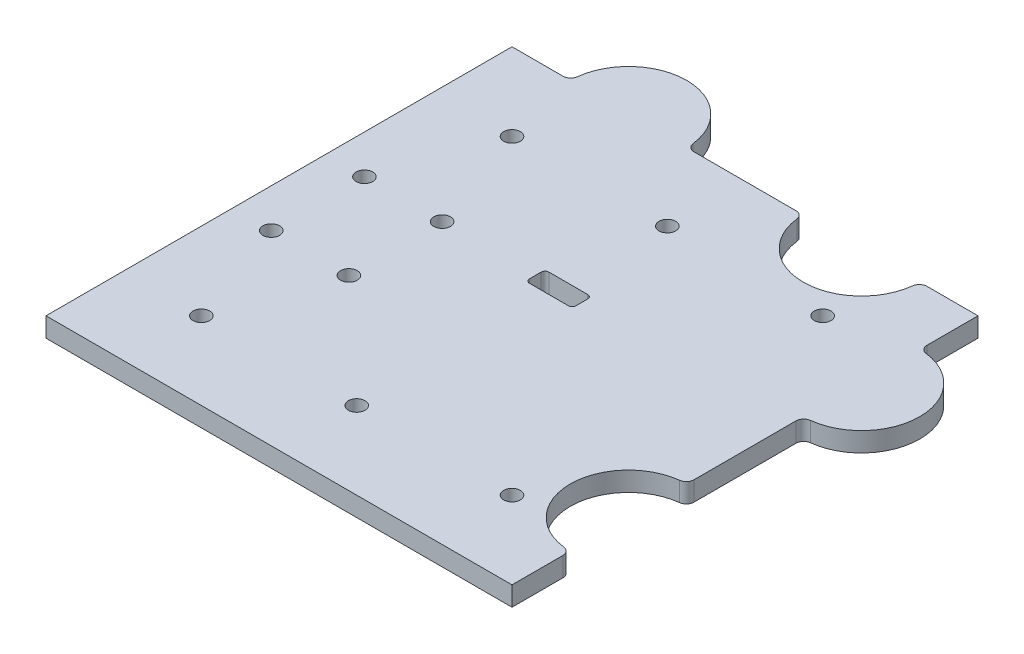
from build123d import *

# Parameters (mm, degrees)
SKETCH1_R           = 2.15
SKETCH1_W           = 12
SKETCH1_H           = 5
BOSS_EXTRUDE2_DEPTH = 5
FILLET1_R           = 2
FILLET2_R           = 1


with BuildPart() as part:
    # Sketch1 → Boss-Extrude2 (new body)
    with BuildSketch(Plane(origin=(0, 0, 0), x_dir=(1, 0, 0), z_dir=(0, 1, 0))):
        with BuildLine():
            Line((60, -60), (-60, -60))
            Line((-60, -60), (-60, 60))
            Line((-60, 60), (-45, 60))
            ThreePointArc((-45, 60), (-30, 75), (-15, 60))
            Line((-15, 60), (15, 60))
            ThreePointArc((15, 60), (30, 45), (45, 60))
            Line((45, 60), (60, 60))
            Line((60, 60), (60, 45))
            ThreePointArc((60, 45), (75, 30), (60, 15))
            Line((60, 15), (60, -15))
            ThreePointArc((60, -15), (45, -30), (60, -45))
            Line((60, -45), (60, -60))
        make_face()
        with Locations((-50, 12)):
            Circle(SKETCH1_R, mode=Mode.SUBTRACT)
        with Locations((-30, 12)):
            Circle(SKETCH1_R, mode=Mode.SUBTRACT)
        with Locations((-30, -12)):
            Circle(SKETCH1_R, mode=Mode.SUBTRACT)
        with Locations((-50, -12)):
            Circle(SKETCH1_R, mode=Mode.SUBTRACT)
        with Locations((-40, 40)):
            Circle(SKETCH1_R, mode=Mode.SUBTRACT)
        with Locations((40, 40)):
            Circle(SKETCH1_R, mode=Mode.SUBTRACT)
        with Locations((40, -40)):
            Circle(SKETCH1_R, mode=Mode.SUBTRACT)
        with Locations((-40, -40)):
            Circle(SKETCH1_R, mode=Mode.SUBTRACT)
        with Locations((0, 40)):
            Circle(SKETCH1_R, mode=Mode.SUBTRACT)
        with Locations((0, -40)):
            Circle(SKETCH1_R, mode=Mode.SUBTRACT)
        with Locations((0, 12)):
            Rectangle(SKETCH1_W, SKETCH1_H, mode=Mode.SUBTRACT)
    extrude(amount=BOSS_EXTRUDE2_DEPTH)

    # Fillet1
    fillet1_edges = [part.edges().sort_by_distance(p)[0] for p in [
        (60, 2.5, -45),
        (45, 2.5, -60),
        (-45, 2.5, -60),
        (-15, 2.5, -60),
        (15, 2.5, -60),
        (60, 2.5, 45),
        (60, 2.5, 15),
        (60, 2.5, -15),
    ]]
    fillet(fillet1_edges, radius=FILLET1_R)

    # Fillet2
    fillet2_edges = [part.edges().sort_by_distance(p)[0] for p in [
        (-6, 2.5, -14.5),
        (-6, 2.5, -9.5),
        (6, 2.5, -9.5),
        (6, 2.5, -14.5),
    ]]
    fillet(fillet2_edges, radius=FILLET2_R)


solid = part.part
